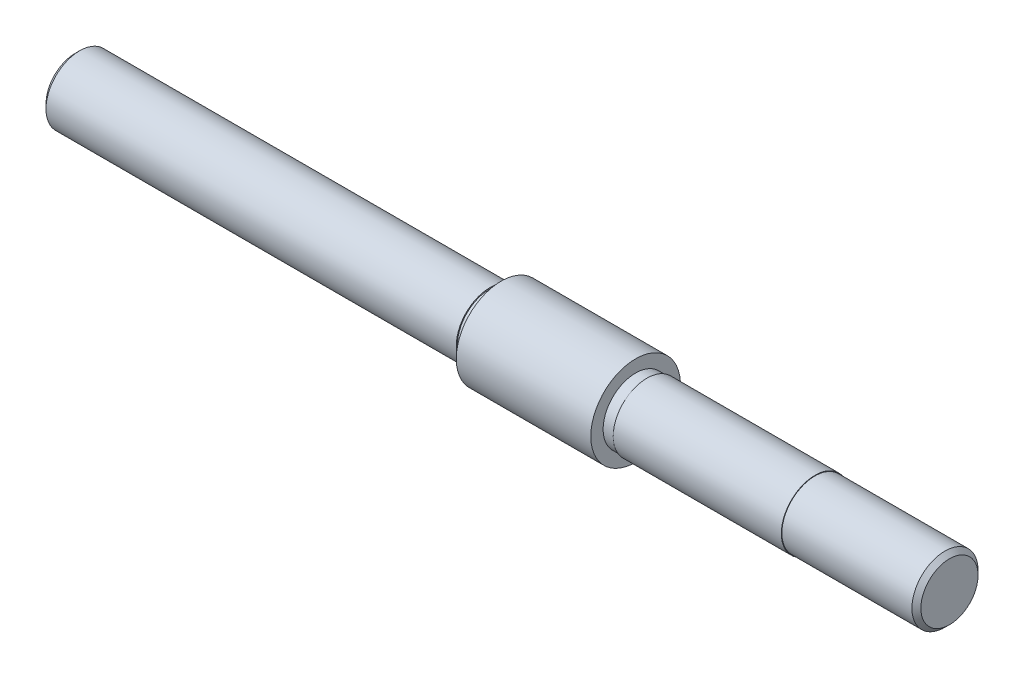
from build123d import *

# Parameters (mm, degrees)
CHAMFER_1_SIZE = 0.2


with BuildPart() as part:
    # 草图1 → 旋转1 (revolve)
    with BuildSketch(Plane.XY, mode=Mode.PRIVATE) as revolve_1_sk:
        Polygon((0, 0), (0, 1.475), (-6, 1.475), (-6, 1.5), (-13.5, 1.5), (-13.5, 1.45), (-14, 1.45), (-14, 2), (-20, 2), (-20, 1.45), (-20.5, 1.45), (-20.5, 1.5), (-39, 1.5), (-39, 0), align=None)
    revolve(revolve_1_sk.sketch.rotate(Axis((-12.088767593, 0, 0), (1, 0, 0)), 90), axis=Axis((-12.088767593, 0, 0), (1, 0, 0)))

    # 倒角1
    chamfer_1_edges = [part.edges().sort_by_distance(p)[0] for p in [
        (0, 0, -1.475),
        (-39, 0, -1.5),
    ]]
    chamfer(chamfer_1_edges, length=CHAMFER_1_SIZE)


solid = part.part
